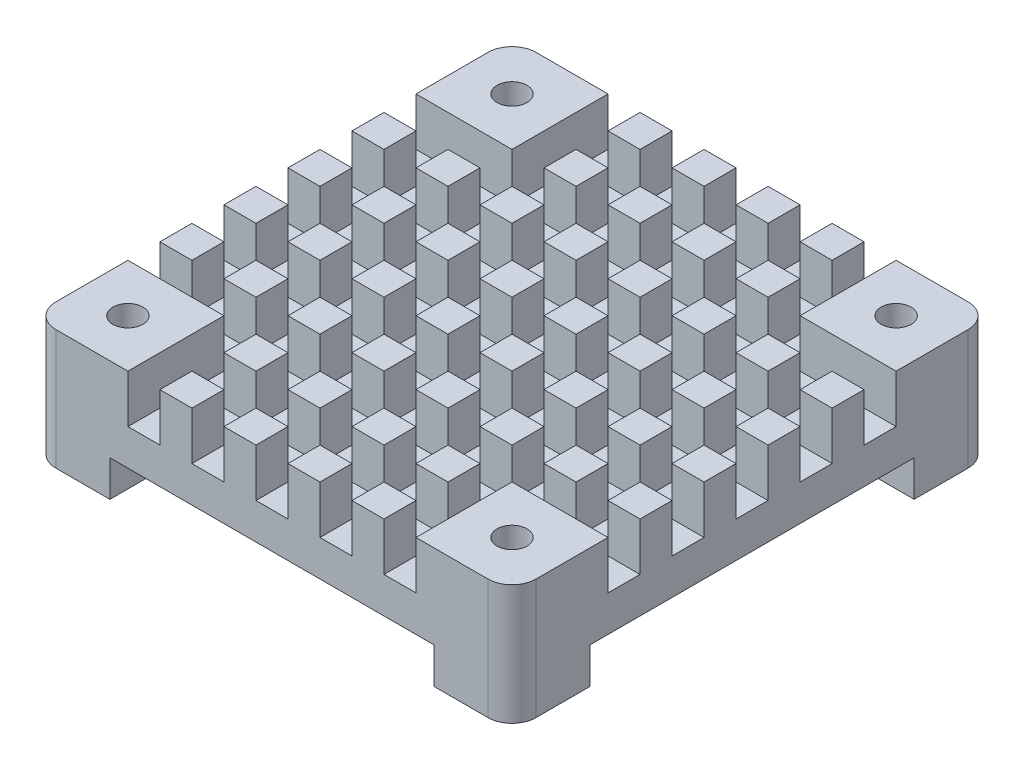
from build123d import *
from build123d.topology import SkipClean

# Parameters (mm, degrees)
SKETCH_2_W      = 40
SKETCH_2_H      = 40
SKETCH_2_R      = 1.25
EXTRUDE_1_DEPTH = 3
SKETCH_3_W      = 2.666666666
SKETCH_3_H      = 2.666666667
SKETCH_3_W_2    = 8
SKETCH_3_H_2    = 8
SKETCH_3_R      = 1.25
SKETCH_3_W_3    = 2.666666667
SKETCH_3_H_3    = 2.666666666
EXTRUDE_2_DEPTH = 4
EXTRUDE_START   = 3
SKETCH_4_W      = 6.5
SKETCH_4_H      = 6.5
SKETCH_4_R      = 1.25
EXTRUDE_3_DEPTH = 3
FILLET_1_R      = 2


with BuildPart() as part:
    # 草图2 → 凸台-拉伸1 (new body)
    with BuildSketch(Plane(origin=(0, 0, 0), x_dir=(1, 0, 0), z_dir=(0, 1, 0))):
        Rectangle(SKETCH_2_W, SKETCH_2_H)
        with Locations(Location((-16, 16, 0), (0, 0, 270))):
            Circle(SKETCH_2_R, mode=Mode.SUBTRACT)
        with Locations(Location((16, 16, 0), (0, 0, 270))):
            Circle(SKETCH_2_R, mode=Mode.SUBTRACT)
        with Locations(Location((16, -16, 0), (0, 0, 270))):
            Circle(SKETCH_2_R, mode=Mode.SUBTRACT)
        with Locations(Location((-16, -16, 0), (0, 0, 270))):
            Circle(SKETCH_2_R, mode=Mode.SUBTRACT)
    extrude(amount=EXTRUDE_1_DEPTH)

    # 草图3 → 凸台-拉伸2 (add)
    # profile 1 of 52: a face of its own
    with BuildSketch(Plane(origin=(0, 3, 0), x_dir=(1, 0, 0), z_dir=(0, 1, 0))):
        with Locations((8, -13.333333334)):
            Rectangle(SKETCH_3_W, SKETCH_3_H)
    # profile 2 of 52: a face of its own
    with BuildSketch(Plane(origin=(0, 3, 0), x_dir=(1, 0, 0), z_dir=(0, 1, 0))):
        with Locations((16, -16)):
            Rectangle(SKETCH_3_W_2, SKETCH_3_H_2)
        with Locations(Location((16, -16, 0), (0, 0, 270))):
            Circle(SKETCH_3_R, mode=Mode.SUBTRACT)
    # profile 3 of 52: a face of its own
    with BuildSketch(Plane(origin=(0, 3, 0), x_dir=(1, 0, 0), z_dir=(0, 1, 0))):
        with Locations((16, 16)):
            Rectangle(SKETCH_3_W_2, SKETCH_3_H_2)
        with Locations(Location((16, 16, 0), (0, 0, 270))):
            Circle(SKETCH_3_R, mode=Mode.SUBTRACT)
    # profile 4 of 52: a face of its own
    with BuildSketch(Plane(origin=(0, 3, 0), x_dir=(1, 0, 0), z_dir=(0, 1, 0))):
        with Locations((-16, 16)):
            Rectangle(SKETCH_3_W_2, SKETCH_3_H_2)
        with Locations(Location((-16, 16, 0), (0, 0, 270))):
            Circle(SKETCH_3_R, mode=Mode.SUBTRACT)
    # profile 5 of 52: a face of its own
    with BuildSketch(Plane(origin=(0, 3, 0), x_dir=(1, 0, 0), z_dir=(0, 1, 0))):
        with Locations((-16, -16)):
            Rectangle(SKETCH_3_W_2, SKETCH_3_H_2)
        with Locations(Location((-16, -16, 0), (0, 0, 270))):
            Circle(SKETCH_3_R, mode=Mode.SUBTRACT)
    # profile 6 of 52: a face of its own
    with BuildSketch(Plane(origin=(0, 3, 0), x_dir=(1, 0, 0), z_dir=(0, 1, 0))):
        with Locations((18.666666666, 8)):
            Rectangle(SKETCH_3_W_3, SKETCH_3_H_3)
    # profile 7 of 52: a face of its own
    with BuildSketch(Plane(origin=(0, 3, 0), x_dir=(1, 0, 0), z_dir=(0, 1, 0))):
        with Locations((18.666666666, 2.666666667)):
            Rectangle(SKETCH_3_W_3, SKETCH_3_H)
    # profile 8 of 52: a face of its own
    with BuildSketch(Plane(origin=(0, 3, 0), x_dir=(1, 0, 0), z_dir=(0, 1, 0))):
        with Locations((18.666666666, -2.666666667)):
            Rectangle(SKETCH_3_W_3, SKETCH_3_H)
    # profile 9 of 52: a face of its own
    with BuildSketch(Plane(origin=(0, 3, 0), x_dir=(1, 0, 0), z_dir=(0, 1, 0))):
        with Locations((18.666666666, -8)):
            Rectangle(SKETCH_3_W_3, SKETCH_3_H_3)
    # profile 10 of 52: a face of its own
    with BuildSketch(Plane(origin=(0, 3, 0), x_dir=(1, 0, 0), z_dir=(0, 1, 0))):
        with Locations((-13.333333334, 8)):
            Rectangle(SKETCH_3_W_3, SKETCH_3_H_3)
    # profile 11 of 52: a face of its own
    with BuildSketch(Plane(origin=(0, 3, 0), x_dir=(1, 0, 0), z_dir=(0, 1, 0))):
        with Locations((-8, 18.666666666)):
            Rectangle(SKETCH_3_W, SKETCH_3_H)
    # profile 12 of 52: a face of its own
    with BuildSketch(Plane(origin=(0, 3, 0), x_dir=(1, 0, 0), z_dir=(0, 1, 0))):
        with Locations((-18.666666666, 2.666666667)):
            Rectangle(SKETCH_3_W_3, SKETCH_3_H)
    # profile 13 of 52: a face of its own
    with BuildSketch(Plane(origin=(0, 3, 0), x_dir=(1, 0, 0), z_dir=(0, 1, 0))):
        with Locations((-2.666666667, 18.666666666)):
            Rectangle(SKETCH_3_W_3, SKETCH_3_H)
    # profile 14 of 52: a face of its own
    with BuildSketch(Plane(origin=(0, 3, 0), x_dir=(1, 0, 0), z_dir=(0, 1, 0))):
        with Locations((2.666666667, 18.666666666)):
            Rectangle(SKETCH_3_W_3, SKETCH_3_H)
    # profile 15 of 52: a face of its own
    with BuildSketch(Plane(origin=(0, 3, 0), x_dir=(1, 0, 0), z_dir=(0, 1, 0))):
        with Locations((8, 18.666666666)):
            Rectangle(SKETCH_3_W, SKETCH_3_H)
    # profile 16 of 52: a face of its own
    with BuildSketch(Plane(origin=(0, 3, 0), x_dir=(1, 0, 0), z_dir=(0, 1, 0))):
        with Locations((-13.333333334, 2.666666667)):
            Rectangle(SKETCH_3_W_3, SKETCH_3_H)
    # profile 17 of 52: a face of its own
    with BuildSketch(Plane(origin=(0, 3, 0), x_dir=(1, 0, 0), z_dir=(0, 1, 0))):
        with Locations((8, -18.666666666)):
            Rectangle(SKETCH_3_W, SKETCH_3_H)
    # profile 18 of 52: a face of its own
    with BuildSketch(Plane(origin=(0, 3, 0), x_dir=(1, 0, 0), z_dir=(0, 1, 0))):
        with Locations((-18.666666666, 8)):
            Rectangle(SKETCH_3_W_3, SKETCH_3_H_3)
    # profile 19 of 52: a face of its own
    with BuildSketch(Plane(origin=(0, 3, 0), x_dir=(1, 0, 0), z_dir=(0, 1, 0))):
        with Locations((8, 13.333333334)):
            Rectangle(SKETCH_3_W, SKETCH_3_H)
    # profile 20 of 52: a face of its own
    with BuildSketch(Plane(origin=(0, 3, 0), x_dir=(1, 0, 0), z_dir=(0, 1, 0))):
        with Locations((13.333333334, 8)):
            Rectangle(SKETCH_3_W_3, SKETCH_3_H_3)
    # profile 21 of 52: a face of its own
    with BuildSketch(Plane(origin=(0, 3, 0), x_dir=(1, 0, 0), z_dir=(0, 1, 0))):
        with Locations((-13.333333334, -2.666666667)):
            Rectangle(SKETCH_3_W_3, SKETCH_3_H)
    # profile 22 of 52: a face of its own
    with BuildSketch(Plane(origin=(0, 3, 0), x_dir=(1, 0, 0), z_dir=(0, 1, 0))):
        with Locations((-13.333333334, -8)):
            Rectangle(SKETCH_3_W_3, SKETCH_3_H_3)
    # profile 23 of 52: a face of its own
    with BuildSketch(Plane(origin=(0, 3, 0), x_dir=(1, 0, 0), z_dir=(0, 1, 0))):
        with Locations((-8, -18.666666666)):
            Rectangle(SKETCH_3_W, SKETCH_3_H)
    # profile 24 of 52: a face of its own
    with BuildSketch(Plane(origin=(0, 3, 0), x_dir=(1, 0, 0), z_dir=(0, 1, 0))):
        with Locations((-8, -13.333333334)):
            Rectangle(SKETCH_3_W, SKETCH_3_H)
    # profile 25 of 52: a face of its own
    with BuildSketch(Plane(origin=(0, 3, 0), x_dir=(1, 0, 0), z_dir=(0, 1, 0))):
        with Locations((-2.666666667, -13.333333334)):
            Rectangle(SKETCH_3_W_3, SKETCH_3_H)
    # profile 26 of 52: a face of its own
    with BuildSketch(Plane(origin=(0, 3, 0), x_dir=(1, 0, 0), z_dir=(0, 1, 0))):
        with Locations((2.666666667, -13.333333334)):
            Rectangle(SKETCH_3_W_3, SKETCH_3_H)
    # profile 27 of 52: a face of its own
    with BuildSketch(Plane(origin=(0, 3, 0), x_dir=(1, 0, 0), z_dir=(0, 1, 0))):
        with Locations((8, 8)):
            Rectangle(SKETCH_3_W, SKETCH_3_H_3)
    # profile 28 of 52: a face of its own
    with BuildSketch(Plane(origin=(0, 3, 0), x_dir=(1, 0, 0), z_dir=(0, 1, 0))):
        with Locations((8, 2.666666667)):
            Rectangle(SKETCH_3_W, SKETCH_3_H)
    # profile 29 of 52: a face of its own
    with BuildSketch(Plane(origin=(0, 3, 0), x_dir=(1, 0, 0), z_dir=(0, 1, 0))):
        with Locations((8, -2.666666667)):
            Rectangle(SKETCH_3_W, SKETCH_3_H)
    # profile 30 of 52: a face of its own
    with BuildSketch(Plane(origin=(0, 3, 0), x_dir=(1, 0, 0), z_dir=(0, 1, 0))):
        with Locations((8, -8)):
            Rectangle(SKETCH_3_W, SKETCH_3_H_3)
    # profile 31 of 52: a face of its own
    with BuildSketch(Plane(origin=(0, 3, 0), x_dir=(1, 0, 0), z_dir=(0, 1, 0))):
        with Locations((-8, 8)):
            Rectangle(SKETCH_3_W, SKETCH_3_H_3)
    # profile 32 of 52: a face of its own
    with BuildSketch(Plane(origin=(0, 3, 0), x_dir=(1, 0, 0), z_dir=(0, 1, 0))):
        with Locations((-2.666666667, 8)):
            Rectangle(SKETCH_3_W_3, SKETCH_3_H_3)
    # profile 33 of 52: a face of its own
    with BuildSketch(Plane(origin=(0, 3, 0), x_dir=(1, 0, 0), z_dir=(0, 1, 0))):
        with Locations((2.666666667, 8)):
            Rectangle(SKETCH_3_W_3, SKETCH_3_H_3)
    # profile 34 of 52: a face of its own
    with BuildSketch(Plane(origin=(0, 3, 0), x_dir=(1, 0, 0), z_dir=(0, 1, 0))):
        with Locations((-8, 2.666666667)):
            Rectangle(SKETCH_3_W, SKETCH_3_H)
    # profile 35 of 52: a face of its own
    with BuildSketch(Plane(origin=(0, 3, 0), x_dir=(1, 0, 0), z_dir=(0, 1, 0))):
        with Locations((-2.666666667, 2.666666667)):
            Rectangle(SKETCH_3_W_3, SKETCH_3_H)
    # profile 36 of 52: a face of its own
    with BuildSketch(Plane(origin=(0, 3, 0), x_dir=(1, 0, 0), z_dir=(0, 1, 0))):
        with Locations((2.666666667, 2.666666667)):
            Rectangle(SKETCH_3_W_3, SKETCH_3_H)
    # profile 37 of 52: a face of its own
    with BuildSketch(Plane(origin=(0, 3, 0), x_dir=(1, 0, 0), z_dir=(0, 1, 0))):
        with Locations((13.333333334, 2.666666667)):
            Rectangle(SKETCH_3_W_3, SKETCH_3_H)
    # profile 38 of 52: a face of its own
    with BuildSketch(Plane(origin=(0, 3, 0), x_dir=(1, 0, 0), z_dir=(0, 1, 0))):
        with Locations((-18.666666666, -2.666666667)):
            Rectangle(SKETCH_3_W_3, SKETCH_3_H)
    # profile 39 of 52: a face of its own
    with BuildSketch(Plane(origin=(0, 3, 0), x_dir=(1, 0, 0), z_dir=(0, 1, 0))):
        with Locations((-8, -2.666666667)):
            Rectangle(SKETCH_3_W, SKETCH_3_H)
    # profile 40 of 52: a face of its own
    with BuildSketch(Plane(origin=(0, 3, 0), x_dir=(1, 0, 0), z_dir=(0, 1, 0))):
        with Locations((-2.666666667, -2.666666667)):
            Rectangle(SKETCH_3_W_3, SKETCH_3_H)
    # profile 41 of 52: a face of its own
    with BuildSketch(Plane(origin=(0, 3, 0), x_dir=(1, 0, 0), z_dir=(0, 1, 0))):
        with Locations((2.666666667, -2.666666667)):
            Rectangle(SKETCH_3_W_3, SKETCH_3_H)
    # profile 42 of 52: a face of its own
    with BuildSketch(Plane(origin=(0, 3, 0), x_dir=(1, 0, 0), z_dir=(0, 1, 0))):
        with Locations((13.333333334, -2.666666667)):
            Rectangle(SKETCH_3_W_3, SKETCH_3_H)
    # profile 43 of 52: a face of its own
    with BuildSketch(Plane(origin=(0, 3, 0), x_dir=(1, 0, 0), z_dir=(0, 1, 0))):
        with Locations((-18.666666666, -8)):
            Rectangle(SKETCH_3_W_3, SKETCH_3_H_3)
    # profile 44 of 52: a face of its own
    with BuildSketch(Plane(origin=(0, 3, 0), x_dir=(1, 0, 0), z_dir=(0, 1, 0))):
        with Locations((-8, -8)):
            Rectangle(SKETCH_3_W, SKETCH_3_H_3)
    # profile 45 of 52: a face of its own
    with BuildSketch(Plane(origin=(0, 3, 0), x_dir=(1, 0, 0), z_dir=(0, 1, 0))):
        with Locations((-2.666666667, -8)):
            Rectangle(SKETCH_3_W_3, SKETCH_3_H_3)
    # profile 46 of 52: a face of its own
    with BuildSketch(Plane(origin=(0, 3, 0), x_dir=(1, 0, 0), z_dir=(0, 1, 0))):
        with Locations((2.666666667, -8)):
            Rectangle(SKETCH_3_W_3, SKETCH_3_H_3)
    # profile 47 of 52: a face of its own
    with BuildSketch(Plane(origin=(0, 3, 0), x_dir=(1, 0, 0), z_dir=(0, 1, 0))):
        with Locations((13.333333334, -8)):
            Rectangle(SKETCH_3_W_3, SKETCH_3_H_3)
    # profile 48 of 52: a face of its own
    with BuildSketch(Plane(origin=(0, 3, 0), x_dir=(1, 0, 0), z_dir=(0, 1, 0))):
        with Locations((-8, 13.333333334)):
            Rectangle(SKETCH_3_W, SKETCH_3_H)
    # profile 49 of 52: a face of its own
    with BuildSketch(Plane(origin=(0, 3, 0), x_dir=(1, 0, 0), z_dir=(0, 1, 0))):
        with Locations((-2.666666667, -18.666666666)):
            Rectangle(SKETCH_3_W_3, SKETCH_3_H)
    # profile 50 of 52: a face of its own
    with BuildSketch(Plane(origin=(0, 3, 0), x_dir=(1, 0, 0), z_dir=(0, 1, 0))):
        with Locations((-2.666666667, 13.333333334)):
            Rectangle(SKETCH_3_W_3, SKETCH_3_H)
    # profile 51 of 52: a face of its own
    with BuildSketch(Plane(origin=(0, 3, 0), x_dir=(1, 0, 0), z_dir=(0, 1, 0))):
        with Locations((2.666666667, -18.666666666)):
            Rectangle(SKETCH_3_W_3, SKETCH_3_H)
    # profile 52 of 52: a face of its own
    with BuildSketch(Plane(origin=(0, 3, 0), x_dir=(1, 0, 0), z_dir=(0, 1, 0))):
        with Locations((2.666666667, 13.333333334)):
            Rectangle(SKETCH_3_W_3, SKETCH_3_H)
    extrude(amount=EXTRUDE_2_DEPTH)

    # 草图4 → 凸台-拉伸3 (add)
    # profile 1 of 4: a face of its own
    with SkipClean():  # the faces are left unmerged after this step: merging them gives an invalid solid
        with BuildSketch(Plane.XZ.offset(EXTRUDE_START)):
            with Locations((-16.75, 16.75)):
                Rectangle(SKETCH_4_W, SKETCH_4_H)
            with Locations((-16, 16)):
                Circle(SKETCH_4_R, mode=Mode.SUBTRACT)
        # profile 2 of 4: a face of its own
        with BuildSketch(Plane.XZ.offset(EXTRUDE_START)):
            with Locations((-16.75, -16.75)):
                Rectangle(SKETCH_4_W, SKETCH_4_H)
            with Locations((-16, -16)):
                Circle(SKETCH_4_R, mode=Mode.SUBTRACT)
        # profile 3 of 4: a face of its own
        with BuildSketch(Plane.XZ.offset(EXTRUDE_START)):
            with Locations((16.75, 16.75)):
                Rectangle(SKETCH_4_W, SKETCH_4_H)
            with Locations((16, 16)):
                Circle(SKETCH_4_R, mode=Mode.SUBTRACT)
        # profile 4 of 4: a face of its own
        with BuildSketch(Plane.XZ.offset(EXTRUDE_START)):
            with Locations((16.75, -16.75)):
                Rectangle(SKETCH_4_W, SKETCH_4_H)
            with Locations((16, -16)):
                Circle(SKETCH_4_R, mode=Mode.SUBTRACT)
        extrude(amount=-EXTRUDE_3_DEPTH)

    # 圆角1
    fillet_1_edges = [part.edges().sort_by_distance(p)[0] for p in [
        (20, 3.5, 20),
        (-20, 3.5, 20),
        (-20, 3.5, -20),
        (20, 3.5, -20),
    ]]
    fillet(fillet_1_edges, radius=FILLET_1_R)


solid = part.part
